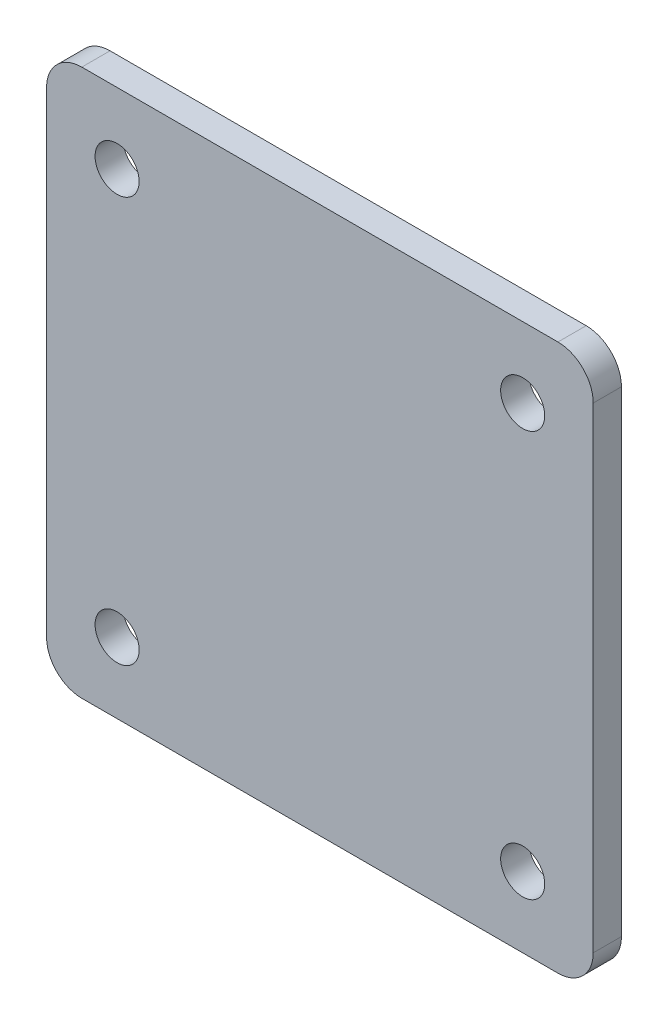
from build123d import *

# Parameters (mm, degrees)
BOSS_EXTRUDE1_DEPTH   = 1.6
F_2_5MM_DOWEL_HOLE1_D = 2.5


with BuildPart() as part:
    # Sketch1 → Boss-Extrude1 (new body)
    with BuildSketch(Plane.XY):
        with BuildLine():
            Line((-13.5, -15.5), (13.5, -15.5))
            ThreePointArc((13.5, -15.5), (14.914213562, -14.914213562), (15.5, -13.5))
            Line((15.5, -13.5), (15.5, 13.5))
            ThreePointArc((15.5, 13.5), (14.914213562, 14.914213562), (13.5, 15.5))
            Line((13.5, 15.5), (-13.5, 15.5))
            ThreePointArc((-13.5, 15.5), (-14.914213562, 14.914213562), (-15.5, 13.5))
            Line((-15.5, 13.5), (-15.5, -13.5))
            ThreePointArc((-15.5, -13.5), (-14.914213562, -14.914213562), (-13.5, -15.5))
        make_face()
    extrude(amount=BOSS_EXTRUDE1_DEPTH)

    # Ø2.5mm Dowel Hole1 (through all)
    with Locations(Plane.XY.offset(1.6)):
        with Locations((-11.5, 11.5), (11.5, 11.5), (11.5, -11.5), (-11.5, -11.5)):
            Hole(F_2_5MM_DOWEL_HOLE1_D / 2)


solid = part.part
